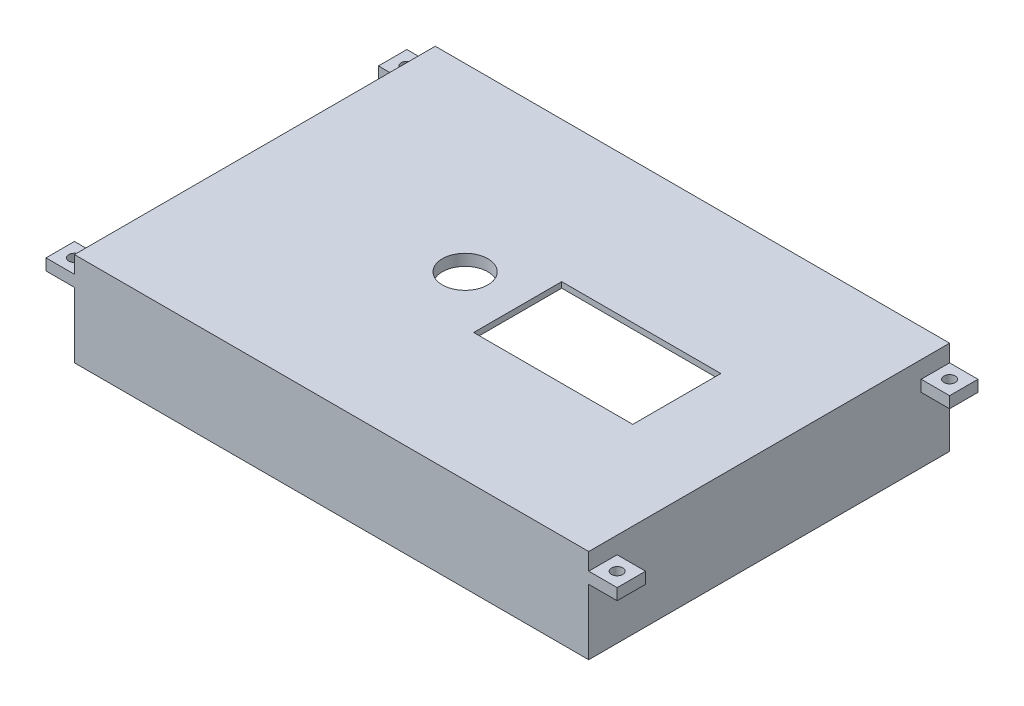
from build123d import *

# Parameters (mm, degrees)
SKETCH1_W           = 86.5
SKETCH1_H           = 59.5
BOSS_EXTRUDE3_DEPTH = 16.5
SKETCH5_W           = 83
SKETCH5_H           = 55.5
CUT_EXTRUDE2_DEPTH  = 10
SKETCH6_R           = 4
SKETCH6_W           = 28
SKETCH6_H           = 15.5
CUT_EXTRUDE5_DEPTH  = 6.5
SKETCH10_W          = 79
SKETCH10_H          = 52.175170105
CUT_EXTRUDE7_DEPTH  = 4.5
SKETCH12_W          = 30
SKETCH12_H          = 32.5
CUT_EXTRUDE9_DEPTH  = 1
SKETCH15_W          = 90.5
SKETCH15_H          = 63.5
SKETCH15_W_2        = 86.5
SKETCH15_H_2        = 59.5
BOSS_EXTRUDE4_DEPTH = 16.5
SKETCH16_W          = 3
SKETCH16_H          = 3
CUT_EXTRUDE11_DEPTH = 8
SKETCH21_W          = 5
SKETCH21_H          = 5
SKETCH21_R          = 1
BOSS_EXTRUDE6_DEPTH = 13.5
SKETCH23_W          = 5
SKETCH23_H          = 5
CUT_EXTRUDE12_DEPTH = 11.5
SKETCH24_W          = 5
SKETCH24_H          = 5
CUT_EXTRUDE13_DEPTH = 11.5
SKETCH25_W          = 5
SKETCH25_H          = 5
CUT_EXTRUDE14_DEPTH = 11.5
SKETCH26_W          = 5
SKETCH26_H          = 5
CUT_EXTRUDE15_DEPTH = 11.5


with BuildPart() as part:
    # Sketch1 → Boss-Extrude3 (new body)
    with BuildSketch(Plane(origin=(0, 0, 0), x_dir=(1, 0, 0), z_dir=(0, 1, 0))):
        Rectangle(SKETCH1_W, SKETCH1_H)
    extrude(amount=-BOSS_EXTRUDE3_DEPTH)

    # Sketch5 → Cut-Extrude2 (cut)
    with BuildSketch(Plane.XZ.offset(16.5)):
        Rectangle(SKETCH5_W, SKETCH5_H)
    extrude(amount=-CUT_EXTRUDE2_DEPTH, mode=Mode.SUBTRACT)

    # Sketch6 → Cut-Extrude5 (cut)
    with BuildSketch(Plane(origin=(0, 0, 0), x_dir=(1, 0, 0), z_dir=(0, 1, 0))):
        with Locations(Location((-8.25, 0, 0), (0, 0, 270))):
            Circle(SKETCH6_R)
        with Locations((15.75, -0.75)):
            Rectangle(SKETCH6_W, SKETCH6_H)
    extrude(amount=-CUT_EXTRUDE5_DEPTH, mode=Mode.SUBTRACT)

    # Sketch10 → Cut-Extrude7 (cut)
    with BuildSketch(Plane.XZ.offset(6.5)):
        with Locations((0, -0.337585053)):
            Rectangle(SKETCH10_W, SKETCH10_H)
    extrude(amount=-CUT_EXTRUDE7_DEPTH, mode=Mode.SUBTRACT)

    # Sketch12 → Cut-Extrude9 (cut)
    with BuildSketch(Plane.XZ.offset(2)):
        with Locations((15.75, 3.25)):
            Rectangle(SKETCH12_W, SKETCH12_H)
    extrude(amount=-CUT_EXTRUDE9_DEPTH, mode=Mode.SUBTRACT)

    # Sketch15 → Boss-Extrude4 (add)
    with BuildSketch(Plane.XZ.offset(16.5)):
        Rectangle(SKETCH15_W, SKETCH15_H)
        Rectangle(SKETCH15_W_2, SKETCH15_H_2, mode=Mode.SUBTRACT)
    extrude(amount=-BOSS_EXTRUDE4_DEPTH)

    # Sketch16 → Cut-Extrude11 (cut)
    with BuildSketch(Plane.XZ.offset(16.5)):
        with Locations((-27.5, 29.25)):
            Rectangle(SKETCH16_W, SKETCH16_H)
        with Locations((27.5, 29.25)):
            Rectangle(SKETCH16_W, SKETCH16_H)
        with Locations((43, 22.75)):
            Rectangle(SKETCH16_W, SKETCH16_H)
        with Locations((43, -22.75)):
            Rectangle(SKETCH16_W, SKETCH16_H)
        with Locations((43, 0)):
            Rectangle(SKETCH16_W, SKETCH16_H)
    extrude(amount=-CUT_EXTRUDE11_DEPTH, mode=Mode.SUBTRACT)

    # Sketch21 → Boss-Extrude6 (add)
    # profile 1 of 4: a face of its own
    with BuildSketch(Plane.XZ.offset(16.5)):
        with Locations((-47.75, 29.25)):
            Rectangle(SKETCH21_W, SKETCH21_H)
        with Locations(Location((-47.75, 29.25, 0), (0, 0, 270))):
            Circle(SKETCH21_R, mode=Mode.SUBTRACT)
    # profile 2 of 4: a face of its own
    with BuildSketch(Plane.XZ.offset(16.5)):
        with Locations((47.75, 29.25)):
            Rectangle(SKETCH21_W, SKETCH21_H)
        with Locations(Location((47.75, 29.25, 0), (0, 0, 90))):
            Circle(SKETCH21_R, mode=Mode.SUBTRACT)
    # profile 3 of 4: a face of its own
    with BuildSketch(Plane.XZ.offset(16.5)):
        with Locations((47.75, -29.25)):
            Rectangle(SKETCH21_W, SKETCH21_H)
        with Locations(Location((47.75, -29.25, 0), (0, 0, 270))):
            Circle(SKETCH21_R, mode=Mode.SUBTRACT)
    # profile 4 of 4: a face of its own
    with BuildSketch(Plane.XZ.offset(16.5)):
        with Locations((-47.75, -29.25)):
            Rectangle(SKETCH21_W, SKETCH21_H)
        with Locations(Location((-47.75, -29.25, 0), (0, 0, 90))):
            Circle(SKETCH21_R, mode=Mode.SUBTRACT)
    extrude(amount=-BOSS_EXTRUDE6_DEPTH)

    # Sketch23 → Cut-Extrude12 (cut)
    with BuildSketch(Plane(origin=(0, -16.5, 0), x_dir=(-1, 0, 0), z_dir=(0, -1, 0))):
        with Locations((-47.75, 29.25)):
            Rectangle(SKETCH23_W, SKETCH23_H)
    extrude(amount=-CUT_EXTRUDE12_DEPTH, mode=Mode.SUBTRACT)

    # Sketch24 → Cut-Extrude13 (cut)
    with BuildSketch(Plane.XZ.offset(16.5)):
        with Locations((47.75, 29.25)):
            Rectangle(SKETCH24_W, SKETCH24_H)
    extrude(amount=-CUT_EXTRUDE13_DEPTH, mode=Mode.SUBTRACT)

    # Sketch25 → Cut-Extrude14 (cut)
    with BuildSketch(Plane.XZ.offset(16.5)):
        with Locations((-47.75, 29.25)):
            Rectangle(SKETCH25_W, SKETCH25_H)
    extrude(amount=-CUT_EXTRUDE14_DEPTH, mode=Mode.SUBTRACT)

    # Sketch26 → Cut-Extrude15 (cut)
    with BuildSketch(Plane(origin=(0, -16.5, 0), x_dir=(-1, 0, 0), z_dir=(0, -1, 0))):
        with Locations((47.75, 29.25)):
            Rectangle(SKETCH26_W, SKETCH26_H)
    extrude(amount=-CUT_EXTRUDE15_DEPTH, mode=Mode.SUBTRACT)


solid = part.part
